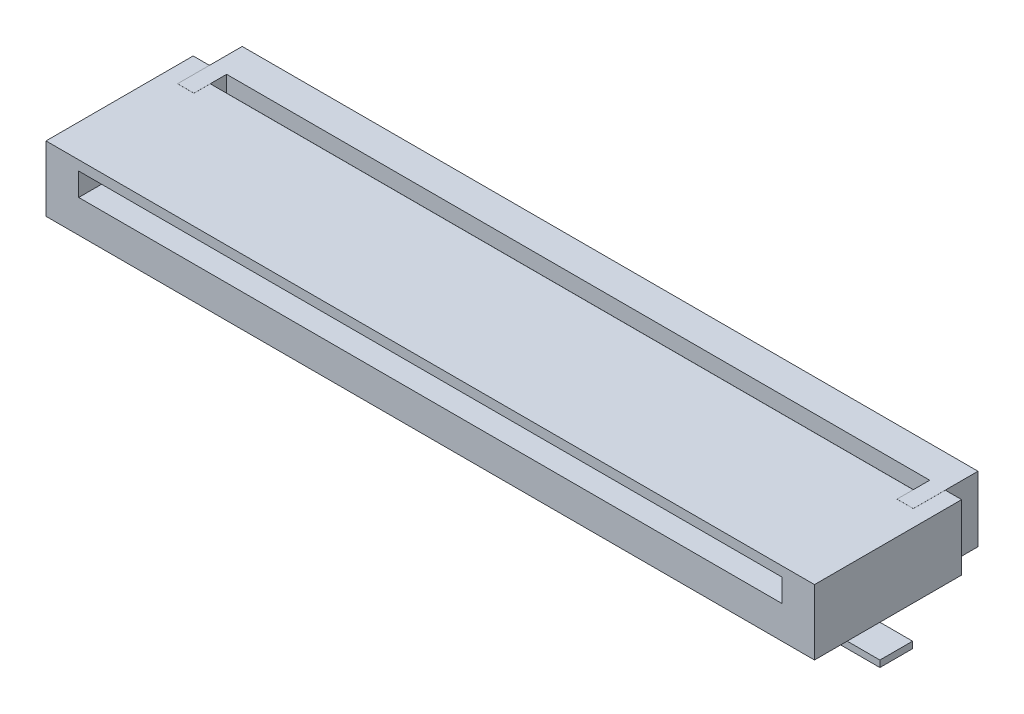
from build123d import *

# Parameters (mm, degrees)
SKETCH_1_W          = 23.5
SKETCH_1_H          = 5.5
EXTRUDE_1_DEPTH     = 2
SKETCH_2_W          = 0.5
SKETCH_2_H          = 1
CUT_EXTRUDE_1_DEPTH = 13.232129823
SKETCH_4_W          = 2
SKETCH_4_H          = 1
EXTRUDE_2_DEPTH     = 0.2
SKETCH_5_W          = 21.5
SKETCH_5_H          = 0.2
EXTRUDE_3_DEPTH     = 0.3
SKETCH_6_W          = 21.5
SKETCH_6_H          = 0.7
CUT_EXTRUDE_2_DEPTH = 4.5
CUT_EXTRUDE_3_DEPTH = 0.002
SKETCH_8_W          = 21.5
SKETCH_8_H          = 0.5
CUT_EXTRUDE_4_DEPTH = 0.5


with BuildPart() as part:
    # 草图1 → 凸台-拉伸1 (new body)
    with BuildSketch(Plane(origin=(0, 0, 0), x_dir=(1, 0, 0), z_dir=(0, 1, 0))):
        Rectangle(SKETCH_1_W, SKETCH_1_H)
    extrude(amount=EXTRUDE_1_DEPTH)

    # 草图2 → 切除-拉伸1 (cut, through all)
    with BuildSketch(Plane(origin=(0, 2, 0), x_dir=(1, 0, 0), z_dir=(0, 1, 0))):
        with Locations((-11.5, 2.25)):
            Rectangle(SKETCH_2_W, SKETCH_2_H)
        with Locations((11.5, 2.25)):
            Rectangle(SKETCH_2_W, SKETCH_2_H)
    extrude(amount=-CUT_EXTRUDE_1_DEPTH, mode=Mode.SUBTRACT)

    # 草图4 → 凸台-拉伸2 (add)
    with BuildSketch(Plane.XZ):
        with Locations((-11.75, 1.25)):
            Rectangle(SKETCH_4_W, SKETCH_4_H)
        with Locations((11.75, 1.25)):
            Rectangle(SKETCH_4_W, SKETCH_4_H)
    extrude(amount=EXTRUDE_2_DEPTH)

    # 草图5 → 凸台-拉伸3 (add)
    with BuildSketch(Plane.XZ):
        with Locations((0, -2.45)):
            Rectangle(SKETCH_5_W, SKETCH_5_H)
    extrude(amount=EXTRUDE_3_DEPTH)

    # 草图6 → 切除-拉伸2 (cut)
    with BuildSketch(Plane.XY.offset(2.75)):
        with Locations((0, 1.35)):
            Rectangle(SKETCH_6_W, SKETCH_6_H)
    extrude(amount=-CUT_EXTRUDE_2_DEPTH, mode=Mode.SUBTRACT)

    # 草图7 → 切除-拉伸3 (cut)
    with BuildSketch(Plane(origin=(0, 2, 0), x_dir=(1, 0, 0), z_dir=(0, 1, 0))):
        Polygon((-11.25, 1.75), (-11.25, 0.773341088), (-10.75, 0.773341088), (-10.75, 1.273341088), (10.75, 1.273341088), (10.75, 0.773341088), (11.25, 0.773341088), (11.25, 1.75), (11.75, 1.75), (11.75, -2.75), (-11.75, -2.75), (-11.75, 1.75), align=None)
    extrude(amount=-CUT_EXTRUDE_3_DEPTH, mode=Mode.SUBTRACT)

    # 草图8 → 切除-拉伸4 (cut)
    with BuildSketch(Plane(origin=(0, 2, 0), x_dir=(1, 0, 0), z_dir=(0, 1, 0))):
        with Locations((0, 1.523341088)):
            Rectangle(SKETCH_8_W, SKETCH_8_H)
    extrude(amount=-CUT_EXTRUDE_4_DEPTH, mode=Mode.SUBTRACT)


solid = part.part
